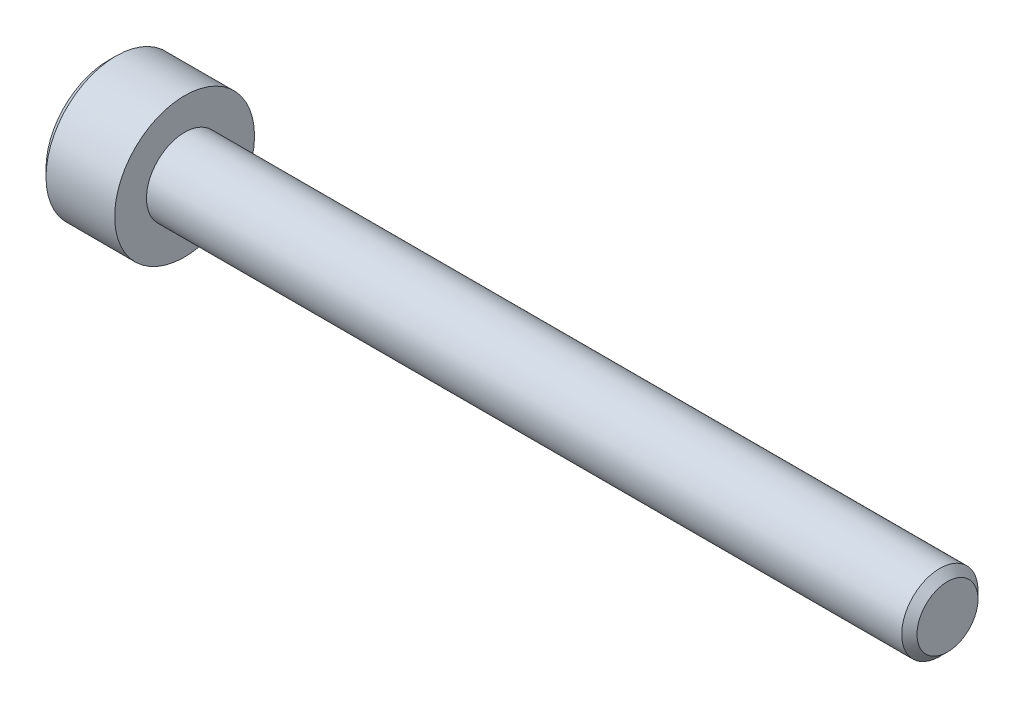
from build123d import *

# Parameters (mm, degrees)
SKETCH1_W           = 3
SKETCH1_H           = 2.75
SKETCH2_R           = 1.5
BOSS_EXTRUDE1_DEPTH = 30
CUT_EXTRUDE1_DEPTH  = 1.5
CHAMFER1_SIZE       = 0.3


with BuildPart() as part:
    # Sketch1 → Revolve1 (revolve)
    with BuildSketch(Plane.XY, mode=Mode.PRIVATE) as revolve1_sk:
        with Locations((-1.5, 1.375)):
            Rectangle(SKETCH1_W, SKETCH1_H)
    revolve(revolve1_sk.sketch.rotate(Axis((-3, 0, 0), (1, 0, 0)), 270), axis=Axis((-3, 0, 0), (1, 0, 0)))

    # Sketch2 → Boss-Extrude1 (add)
    with BuildSketch(Plane(origin=(0, 0, 0), x_dir=(0, 0, -1), z_dir=(1, 0, 0))):
        Circle(SKETCH2_R)
    extrude(amount=BOSS_EXTRUDE1_DEPTH)

    # Sketch3 → Cut-Extrude1 (cut)
    with BuildSketch(Plane.ZY.offset(3)):
        Polygon((1.25, -0.721687836), (1.25, 0.721687836), (0, 1.443375673), (-1.25, 0.721687836), (-1.25, -0.721687836), (0, -1.443375673), align=None)
    extrude(amount=-CUT_EXTRUDE1_DEPTH, mode=Mode.SUBTRACT)

    # Sketch4 → Cut-Revolve1 (revolve, cut)
    with BuildSketch(Plane.XY, mode=Mode.PRIVATE) as cut_revolve1_sk:
        Polygon((-1.5, 1.25), (-1.5, 0), (-1.165063509, 0), align=None)
    revolve(cut_revolve1_sk.sketch.rotate(Axis((-1.500025, 0, 0), (1, 0, 0)), 90), axis=Axis((-1.500025, 0, 0), (1, 0, 0)), mode=Mode.SUBTRACT)

    # Chamfer1
    chamfer1_edges = [part.edges().sort_by_distance(p)[0] for p in [
        (-3, 0, 2.75),
        (30, 0, 1.5),
    ]]
    chamfer(chamfer1_edges, length=CHAMFER1_SIZE)


solid = part.part
